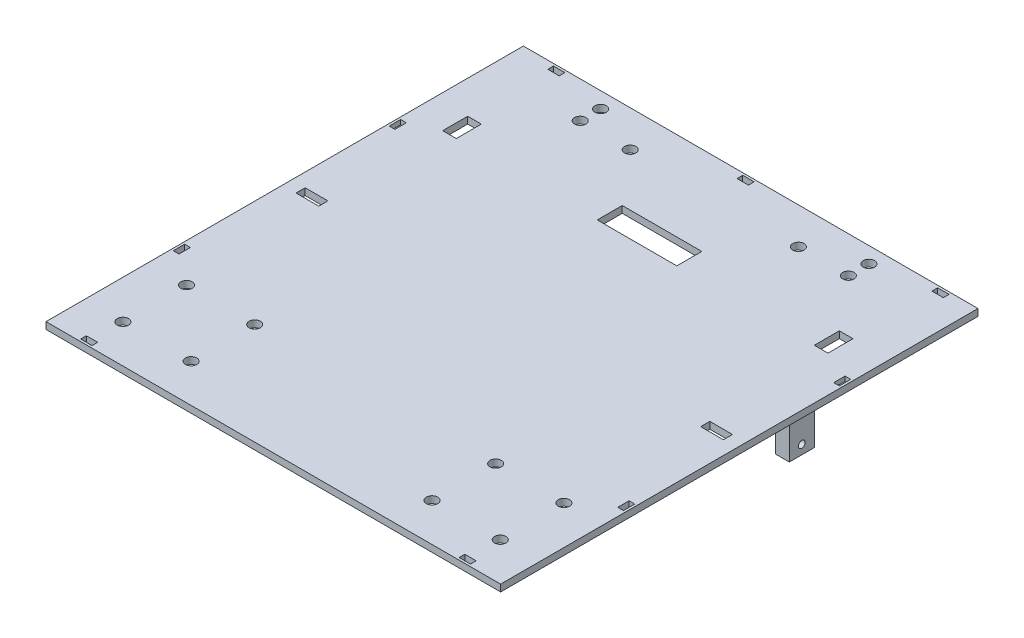
from build123d import *

# Parameters (mm, degrees)
SKETCH1_W              = 2.5
SKETCH1_H              = 5
MAINBODY_DEPTH         = 1
MAINBODY_2_DEPTH       = 1
SAYAPRODA_DEPTH        = 3
SAYAPRODA_DEPTH_BACK   = 30
SKETCH1_4_W            = 6
SKETCH1_4_H            = 11
SAYAPRODA_2_DEPTH      = 3
SAYAPRODA_2_DEPTH_BACK = 30
SKETCH9_W              = 1.5
SKETCH9_H              = 183
HOLE1_AT_2_COUNT       = 2
HOLE1_AT_2_PITCH       = 17
HOLE1_AT_3_COUNT       = 2
HOLE1_AT_3_PITCH       = 18.271297686
HOLE1_AT_4_COUNT       = 2
HOLE1_AT_4_PITCH       = 19.759178985
HOLE1_AT_5_COUNT       = 2
HOLE1_AT_5_PITCH       = 21.121723019
SKETCH1_7_W            = 200
SKETCH1_7_H            = 210
SKETCH1_7_R            = 2.5
SKETCH1_7_R_2          = 2.49585759
SKETCH1_7_W_2          = 10
SKETCH1_7_H_2          = 4
SKETCH1_7_W_3          = 6
SKETCH1_7_H_3          = 11
SKETCH1_7_W_4          = 5
SKETCH1_7_H_4          = 2.5
SKETCH1_7_W_5          = 2.5
SKETCH1_7_H_5          = 5
SKETCH1_7_W_6          = 35
BOSS_EXTRUDE1_DEPTH    = 3


with BuildPart() as part:
    # Sketch1 → MainBody (new body)
    with BuildSketch(Plane(origin=(0, 0, 0), x_dir=(1, 0, 0), z_dir=(0, 1, 0))):
        with Locations((97.75, 47.5)):
            Rectangle(SKETCH1_W, SKETCH1_H)
    extrude(amount=MAINBODY_DEPTH)


with BuildPart() as body_2:
    # Sketch1 → MainBody 2 (new body)
    with BuildSketch(Plane(origin=(0, 0, 0), x_dir=(1, 0, 0), z_dir=(0, 1, 0))):
        with Locations((-97.75, 47.5)):
            Rectangle(SKETCH1_W, SKETCH1_H)
    extrude(amount=MAINBODY_2_DEPTH)


with BuildPart() as body_3:
    # Sketch1<4> → SayapRoda (new, two sides: drawn at the far end of the back side and taken through both)
    with BuildSketch(Plane(origin=(0, 0, 0), x_dir=(1, 0, 0), z_dir=(0, 1, 0)).offset(-SAYAPRODA_DEPTH_BACK)):
        with Locations((-82.5, 43.5)):
            Rectangle(SKETCH1_4_W, SKETCH1_4_H)
    extrude(amount=SAYAPRODA_DEPTH + SAYAPRODA_DEPTH_BACK)


with BuildPart() as body_4:
    # Sketch1<4> → SayapRoda 2 (new, two sides: drawn at the far end of the back side and taken through both)
    with BuildSketch(Plane(origin=(0, 0, 0), x_dir=(1, 0, 0), z_dir=(0, 1, 0)).offset(-SAYAPRODA_2_DEPTH_BACK)):
        with Locations((81, 43.5)):
            Rectangle(SKETCH1_4_W, SKETCH1_4_H)
    extrude(amount=SAYAPRODA_2_DEPTH + SAYAPRODA_2_DEPTH_BACK)


with BuildPart() as hole1_tool:
    # Sketch9 → Hole1 (revolve)
    with BuildSketch(Plane(origin=(84, -26, -43.5), x_dir=(0, 0, -1), z_dir=(0, 1, 0))):
        with Locations((0.75, 91.5)):
            Rectangle(SKETCH9_W, SKETCH9_H)
    hole1 = revolve(axis=Axis((-26, -26, -43.5), (1, 0, 0)))


with BuildPart() as body_3_1:
    add(body_3.part)

    # Hole1: cut by hole1_tool
    add(hole1_tool.part, mode=Mode.SUBTRACT)


with BuildPart() as body_4_1:
    add(body_4.part)

    # Hole1: cut by hole1_tool
    add(hole1_tool.part, mode=Mode.SUBTRACT)


with BuildPart() as hole1_at_2_tool:
    # Hole1 at 2: Hole1 ×2
    with Locations(*[Vector(0, 0.999987624298452, 0.004975062807455084) * (i * HOLE1_AT_2_PITCH) for i in range(1, HOLE1_AT_2_COUNT)]):
        add(hole1)


with BuildPart() as body_3_2:
    add(body_3_1.part)

    # Hole1 at 2: cut by hole1_at_2_tool
    add(hole1_at_2_tool.part, mode=Mode.SUBTRACT)


with BuildPart() as body_4_2:
    add(body_4_1.part)

    # Hole1 at 2: cut by hole1_at_2_tool
    add(hole1_at_2_tool.part, mode=Mode.SUBTRACT)


with BuildPart() as hole1_at_3_tool:
    # Hole1 at 3: Hole1 ×2
    with Locations(*[(0, i * HOLE1_AT_3_PITCH, 0) for i in range(1, HOLE1_AT_3_COUNT)]):
        add(hole1)


with BuildPart() as body_3_3:
    add(body_3_2.part)

    # Hole1 at 3: cut by hole1_at_3_tool
    add(hole1_at_3_tool.part, mode=Mode.SUBTRACT)


with BuildPart() as body_4_3:
    add(body_4_2.part)

    # Hole1 at 3: cut by hole1_at_3_tool
    add(hole1_at_3_tool.part, mode=Mode.SUBTRACT)


with BuildPart() as hole1_at_4_tool:
    # Hole1 at 4: Hole1 ×2
    with Locations(*[(0, i * HOLE1_AT_4_PITCH, 0) for i in range(1, HOLE1_AT_4_COUNT)]):
        add(hole1)


with BuildPart() as body_3_4:
    add(body_3_3.part)

    # Hole1 at 4: cut by hole1_at_4_tool
    add(hole1_at_4_tool.part, mode=Mode.SUBTRACT)


with BuildPart() as body_4_4:
    add(body_4_3.part)

    # Hole1 at 4: cut by hole1_at_4_tool
    add(hole1_at_4_tool.part, mode=Mode.SUBTRACT)


with BuildPart() as hole1_at_5_tool:
    # Hole1 at 5: Hole1 ×2
    with Locations(*[(0, i * HOLE1_AT_5_PITCH, 0) for i in range(1, HOLE1_AT_5_COUNT)]):
        add(hole1)


with BuildPart() as body_3_5:
    add(body_3_4.part)

    # Hole1 at 5: cut by hole1_at_5_tool
    add(hole1_at_5_tool.part, mode=Mode.SUBTRACT)



with BuildPart() as body_4_5:
    add(body_4_4.part)

    # Hole1 at 5: cut by hole1_at_5_tool
    add(hole1_at_5_tool.part, mode=Mode.SUBTRACT)


with BuildPart() as body_3_6:
    add(body_3_5.part)

    add(body_4_5.part)  # Boss-Extrude1 merges body 4
    # Sketch1<7> → Boss-Extrude1 (add)
    with BuildSketch(Plane(origin=(0, 0, 0), x_dir=(1, 0, 0), z_dir=(0, 1, 0))):
        Rectangle(SKETCH1_7_W, SKETCH1_7_H)
        with Locations((-59, 98)):
            Circle(SKETCH1_7_R, mode=Mode.SUBTRACT)
        with Locations((-59, 89)):
            Circle(SKETCH1_7_R, mode=Mode.SUBTRACT)
        with Locations((-37, 89)):
            Circle(SKETCH1_7_R, mode=Mode.SUBTRACT)
        with Locations((59, 98)):
            Circle(SKETCH1_7_R, mode=Mode.SUBTRACT)
        with Locations((59, 89)):
            Circle(SKETCH1_7_R, mode=Mode.SUBTRACT)
        with Locations((37, 89)):
            Circle(SKETCH1_7_R, mode=Mode.SUBTRACT)
        with Locations((83, -88.17530204)):
            Circle(SKETCH1_7_R, mode=Mode.SUBTRACT)
        with Locations((83, -60.17530204)):
            Circle(SKETCH1_7_R_2, mode=Mode.SUBTRACT)
        with Locations((53, -88.17530204)):
            Circle(SKETCH1_7_R, mode=Mode.SUBTRACT)
        with Locations((53, -60.17530204)):
            Circle(SKETCH1_7_R, mode=Mode.SUBTRACT)
        with Locations((-83, -88.17530204)):
            Circle(SKETCH1_7_R, mode=Mode.SUBTRACT)
        with Locations((-53, -88.17530204)):
            Circle(SKETCH1_7_R, mode=Mode.SUBTRACT)
        with Locations((-53, -60.17530204)):
            Circle(SKETCH1_7_R, mode=Mode.SUBTRACT)
        with Locations((-83, -60.17530204)):
            Circle(SKETCH1_7_R, mode=Mode.SUBTRACT)
        with Locations((89, 1)):
            Rectangle(SKETCH1_7_W_2, SKETCH1_7_H_2, mode=Mode.SUBTRACT)
        with Locations((-89, 1)):
            Rectangle(SKETCH1_7_W_2, SKETCH1_7_H_2, mode=Mode.SUBTRACT)
        with Locations((-82.5, 43.5)):
            Rectangle(SKETCH1_7_W_3, SKETCH1_7_H_3, mode=Mode.SUBTRACT)
        with Locations((81, 43.5)):
            Rectangle(SKETCH1_7_W_3, SKETCH1_7_H_3, mode=Mode.SUBTRACT)
        with Locations((83.25, -102.75)):
            Rectangle(SKETCH1_7_W_4, SKETCH1_7_H_4, mode=Mode.SUBTRACT)
        with Locations((0, 102.75)):
            Rectangle(SKETCH1_7_W_4, SKETCH1_7_H_4, mode=Mode.SUBTRACT)
        with Locations((-83.25, -102.75)):
            Rectangle(SKETCH1_7_W_4, SKETCH1_7_H_4, mode=Mode.SUBTRACT)
        with Locations((-83.25, 102.75)):
            Rectangle(SKETCH1_7_W_4, SKETCH1_7_H_4, mode=Mode.SUBTRACT)
        with Locations((85.75, 102.75)):
            Rectangle(SKETCH1_7_W_4, SKETCH1_7_H_4, mode=Mode.SUBTRACT)
        with Locations((97.75, -47.5)):
            Rectangle(SKETCH1_7_W_5, SKETCH1_7_H_5, mode=Mode.SUBTRACT)
        with Locations((97.75, 47.5)):
            Rectangle(SKETCH1_7_W_5, SKETCH1_7_H_5, mode=Mode.SUBTRACT)
        with Locations((-97.75, -47.5)):
            Rectangle(SKETCH1_7_W_5, SKETCH1_7_H_5, mode=Mode.SUBTRACT)
        with Locations((-97.75, 47.5)):
            Rectangle(SKETCH1_7_W_5, SKETCH1_7_H_5, mode=Mode.SUBTRACT)
        with Locations((81, 60.5)):
            Rectangle(SKETCH1_7_W_3, SKETCH1_7_H_3, mode=Mode.SUBTRACT)
        with Locations((-82.5, 60.5)):
            Rectangle(SKETCH1_7_W_3, SKETCH1_7_H_3, mode=Mode.SUBTRACT)
        with Locations((0, 60.5)):
            Rectangle(SKETCH1_7_W_6, SKETCH1_7_H_3, mode=Mode.SUBTRACT)
    extrude(amount=BOSS_EXTRUDE1_DEPTH)


solid = Compound([part.part, body_2.part, body_3_6.part])
